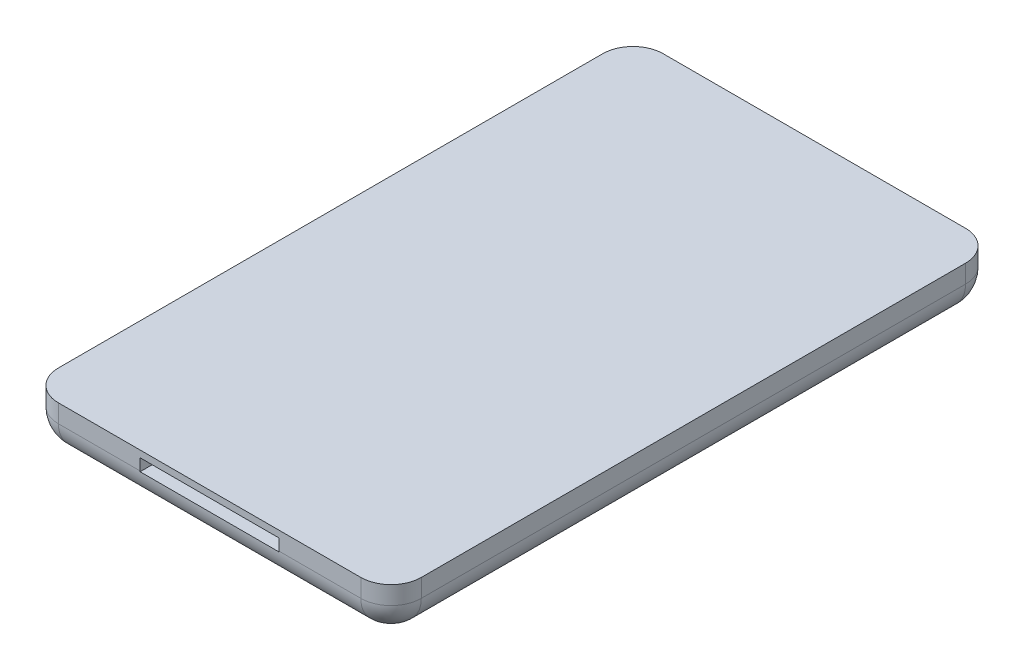
from build123d import *

# Parameters (mm, degrees)
BOSS_EXTRUDE1_DEPTH = 4
FILLET1_R           = 5
SKETCH4_W           = 23
SKETCH4_H           = 2
CUT_EXTRUDE1_DEPTH  = 3
SKETCH5_R           = 1.5
CUT_EXTRUDE2_DEPTH  = 5
CUT_EXTRUDE3_DEPTH  = 1


with BuildPart() as part:
    # Sketch1 → Boss-Extrude1 (new, symmetric)
    with BuildSketch(Plane(origin=(0, 0, 0), x_dir=(1, 0, 0), z_dir=(0, 1, 0))):
        with BuildLine():
            Line((25, -50), (-25, -50))
            ThreePointArc((-25, -50), (-28.535533906, -48.535533906), (-30, -45))
            Line((-30, -45), (-30, 45))
            ThreePointArc((-30, 45), (-28.535533906, 48.535533906), (-25, 50))
            Line((-25, 50), (25, 50))
            ThreePointArc((25, 50), (28.535533906, 48.535533906), (30, 45))
            Line((30, 45), (30, -45))
            ThreePointArc((30, -45), (28.535533906, -48.535533906), (25, -50))
        make_face()
    extrude(amount=BOSS_EXTRUDE1_DEPTH, both=True)

    # Fillet1
    fillet1_edges = [part.edges().sort_by_distance(p)[0] for p in [
        (28.535533906, -4, 48.535533906),
        (30, -4, 0),
        (28.535533906, -4, -48.535533906),
        (0, -4, -50),
        (-28.535533906, -4, -48.535533906),
        (-30, -4, 0),
        (-28.535533906, -4, 48.535533906),
        (0, -4, 50),
    ]]
    fillet(fillet1_edges, radius=FILLET1_R)

    # Sketch4 → Cut-Extrude1 (cut)
    with BuildSketch(Plane.XY.offset(50)):
        with Locations((0, 1.884621544)):
            Rectangle(SKETCH4_W, SKETCH4_H)
    extrude(amount=-CUT_EXTRUDE1_DEPTH, mode=Mode.SUBTRACT)

    # Sketch5 → Cut-Extrude2 (cut)
    with BuildSketch(Plane.ZY.offset(30)):
        with Locations((-43, 1)):
            Circle(SKETCH5_R)
    extrude(amount=-CUT_EXTRUDE2_DEPTH, mode=Mode.SUBTRACT)

    # Sketch6 → Cut-Extrude3 (cut)
    with BuildSketch(Plane.ZY.offset(30)):
        with BuildLine():
            Line((34.15, 2.5), (43.15, 2.5))
            ThreePointArc((43.15, 2.5), (44.65, 1), (43.15, -0.5))
            Line((43.15, -0.5), (34.15, -0.5))
            ThreePointArc((34.15, -0.5), (32.65, 1), (34.15, 2.5))
        make_face()
    extrude(amount=-CUT_EXTRUDE3_DEPTH, mode=Mode.SUBTRACT)


solid = part.part
